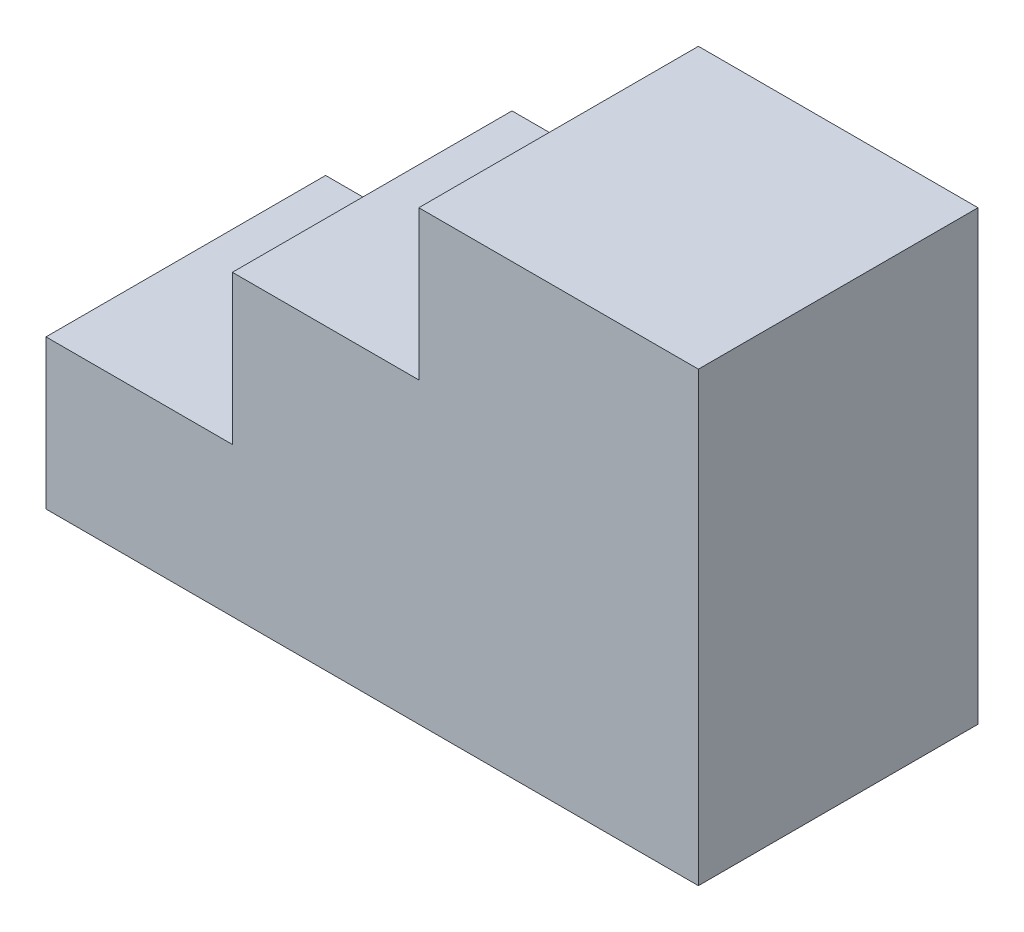
from build123d import *

# Parameters (mm, degrees)
ESCALERA_DEPTH             = 37.5
CROQUIS_AGUJEROS_MONTAJE_R = 4
AGUJERO_INSERTO_M6_DEPTH   = 14


with BuildPart() as part:
    # Croquis_perfil_escalera → Escalera (new, symmetric)
    with BuildSketch(Plane.XY):
        Polygon((-87.5, 0), (87.5, 0), (87.5, 120), (12.5, 120), (12.5, 80), (-37.5, 80), (-37.5, 40), (-87.5, 40), align=None)
    extrude(amount=ESCALERA_DEPTH, both=True)

    # Croquis_agujeros_montaje → Agujero_inserto_M6 (cut)
    with BuildSketch(Plane(origin=(0, 0, 0), x_dir=(1, 0, 0), z_dir=(0, 1, 0))):
        with Locations(Location((-50, 0, 0), (0, 0, 270))):
            Circle(CROQUIS_AGUJEROS_MONTAJE_R)
        with Locations(Location((50, 0, 0), (0, 0, 270))):
            Circle(CROQUIS_AGUJEROS_MONTAJE_R)
    extrude(amount=AGUJERO_INSERTO_M6_DEPTH, mode=Mode.SUBTRACT)


solid = part.part
